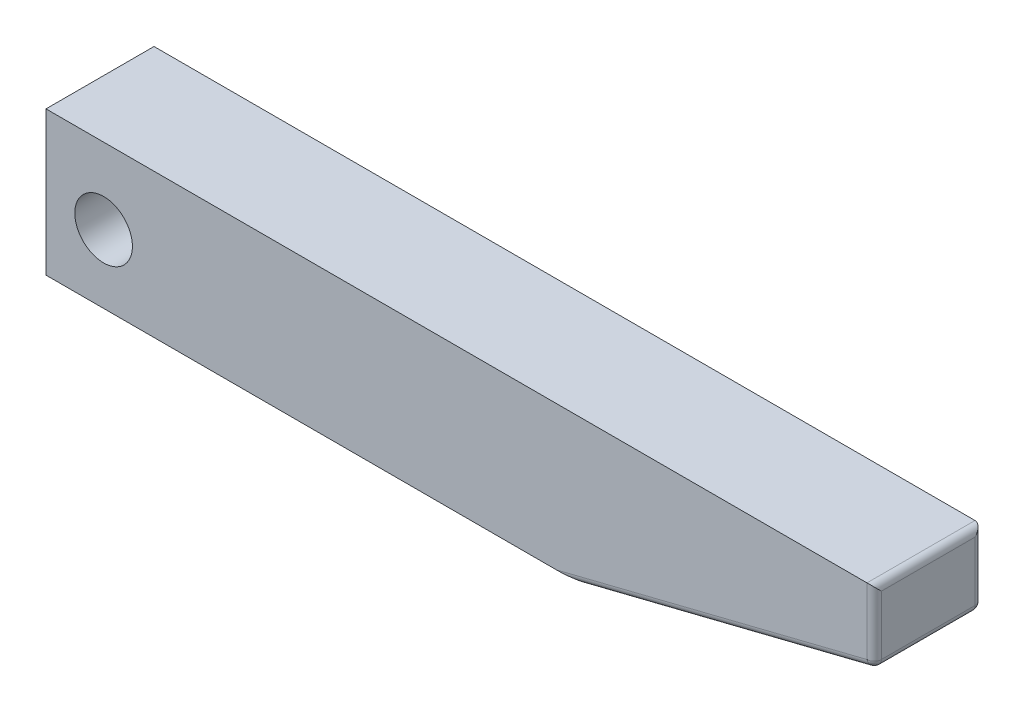
from build123d import *

# Parameters (mm, degrees)
CROQUIS1_W              = 1.15
CROQUIS1_H              = 0.15
SALIENTE_EXTRUIR2_DEPTH = 0.2
CORTAR_EXTRUIR1_DEPTH   = 2.17686023
REDONDEO1_R             = 0.01
CROQUIS3_R              = 0.04
CORTAR_EXTRUIR2_DEPTH   = 2.17686023


with BuildPart() as part:
    # Croquis1 → Saliente-Extruir2 (new body)
    with BuildSketch(Plane(origin=(0, 0, 0), x_dir=(1, 0, 0), z_dir=(0, 1, 0))):
        with Locations((0.575, 0)):
            Rectangle(CROQUIS1_W, CROQUIS1_H)
    extrude(amount=SALIENTE_EXTRUIR2_DEPTH)

    # Croquis2 → Cortar-Extruir1 (cut, through all)
    with BuildSketch(Plane.XY.offset(0.075)):
        Polygon((0.75, 0), (1.15, 0.1), (1.15, 0), align=None)
    extrude(amount=-CORTAR_EXTRUIR1_DEPTH, mode=Mode.SUBTRACT)

    # Redondeo1
    redondeo1_edges = [part.edges().sort_by_distance(p)[0] for p in [
        (1.15, 0.2, 0),
        (0.95, 0.05, -0.075),
        (0.75, 0, 0),
        (1.15, 0.1, 0),
        (0.95, 0.05, 0.075),
        (1.15, 0.15, -0.075),
        (1.15, 0.15, 0.075),
    ]]
    fillet(redondeo1_edges, radius=REDONDEO1_R)

    # Croquis3 → Cortar-Extruir2 (cut, through all)
    with BuildSketch(Plane.XY.offset(0.075)):
        with Locations((0.08, 0.094683269)):
            Circle(CROQUIS3_R)
    extrude(amount=-CORTAR_EXTRUIR2_DEPTH, mode=Mode.SUBTRACT)


solid = part.part
